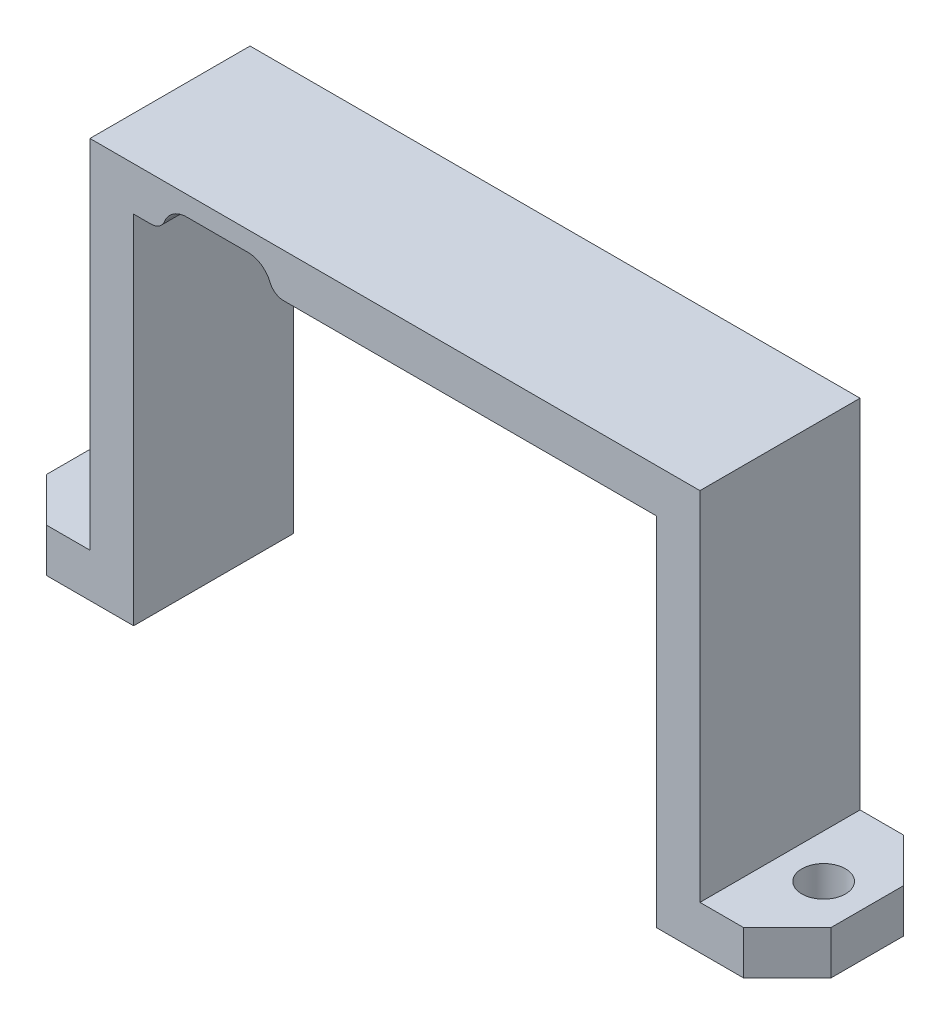
from build123d import *

# Parameters (mm, degrees)
BOSS_EXTRUDE1_DEPTH = 11
CHAMFER1_SIZE       = 3
SKETCH2_R           = 1.5
CUT_EXTRUDE1_DEPTH  = 39.050256569
CUT_EXTRUDE2_DEPTH  = 41.047746816
FILLET1_R           = 1


with BuildPart() as part:
    # Sketch1 → Boss-Extrude1 (new body)
    with BuildSketch(Plane.XY):
        Polygon((-26.955, 0), (-17.955, 0), (-17.955, 24.5), (17.955, 24.5), (17.955, 0), (26.955, 0), (26.955, 3), (20.955, 3), (20.955, 27.5), (-20.955, 27.5), (-20.955, 3), (-26.955, 3), align=None)
    extrude(amount=BOSS_EXTRUDE1_DEPTH)

    # Chamfer1
    chamfer1_edges = [part.edges().sort_by_distance(p)[0] for p in [
        (-26.955, 1.5, 0),
        (26.955, 1.5, 0),
        (26.955, 1.5, 11),
        (-26.955, 1.5, 11),
    ]]
    chamfer(chamfer1_edges, length=CHAMFER1_SIZE)

    # Sketch2 → Cut-Extrude1 (cut, through all)
    with BuildSketch(Plane(origin=(0, 3, 0), x_dir=(1, 0, 0), z_dir=(0, 1, 0))):
        with Locations(Location((-23.955, -5.5, 0), (0, 0, 180))):
            Circle(SKETCH2_R)
        with Locations((23.955, -5.5)):
            Circle(SKETCH2_R)
    extrude(amount=-CUT_EXTRUDE1_DEPTH, mode=Mode.SUBTRACT)

    # Sketch3 → Cut-Extrude2 (cut, through all)
    with BuildSketch(Plane.XY.offset(11)):
        with BuildLine():
            Line((-14.305, 26.15), (-10.105, 26.15))
            ThreePointArc((-10.105, 26.15), (-8.455, 24.5), (-10.105, 22.85))
            Line((-10.105, 22.85), (-14.305, 22.85))
            ThreePointArc((-14.305, 22.85), (-15.955, 24.5), (-14.305, 26.15))
        make_face()
    extrude(amount=-CUT_EXTRUDE2_DEPTH, mode=Mode.SUBTRACT)

    # Fillet1
    fillet1_edges = [part.edges().sort_by_distance(p)[0] for p in [
        (-15.955, 24.5, 5.5),
        (-8.455, 24.5, 5.5),
    ]]
    fillet(fillet1_edges, radius=FILLET1_R)


solid = part.part
